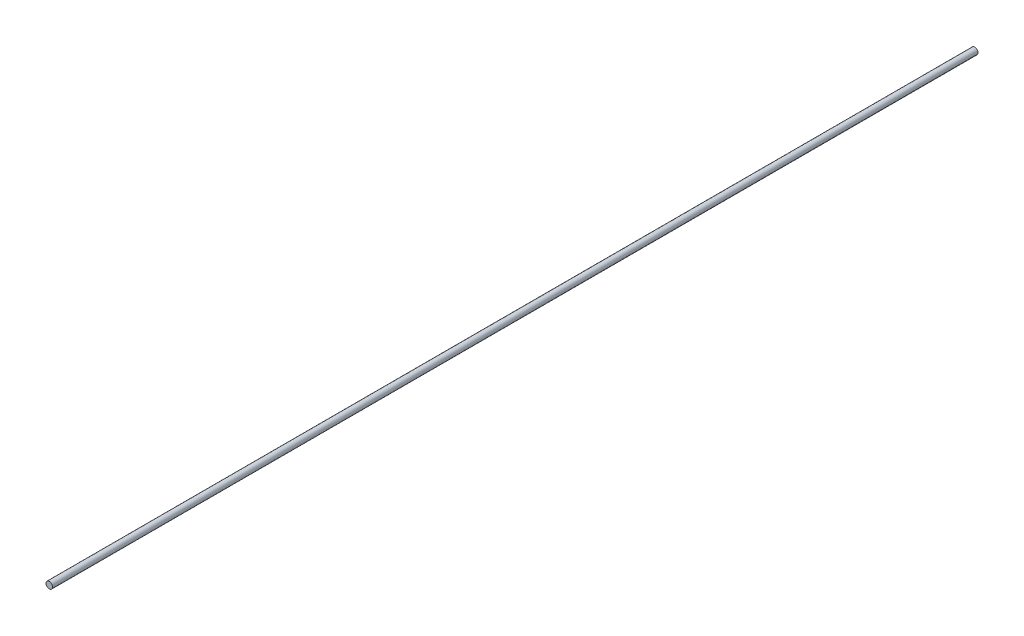
from build123d import *

# Parameters (mm, degrees)
SKETCH1_R           = 7.9375
BOSS_EXTRUDE1_DEPTH = 2254.25


with BuildPart() as part:
    # Sketch1 → Boss-Extrude1 (new body)
    with BuildSketch(Plane.XY):
        Circle(SKETCH1_R)
    extrude(amount=BOSS_EXTRUDE1_DEPTH)


solid = part.part
